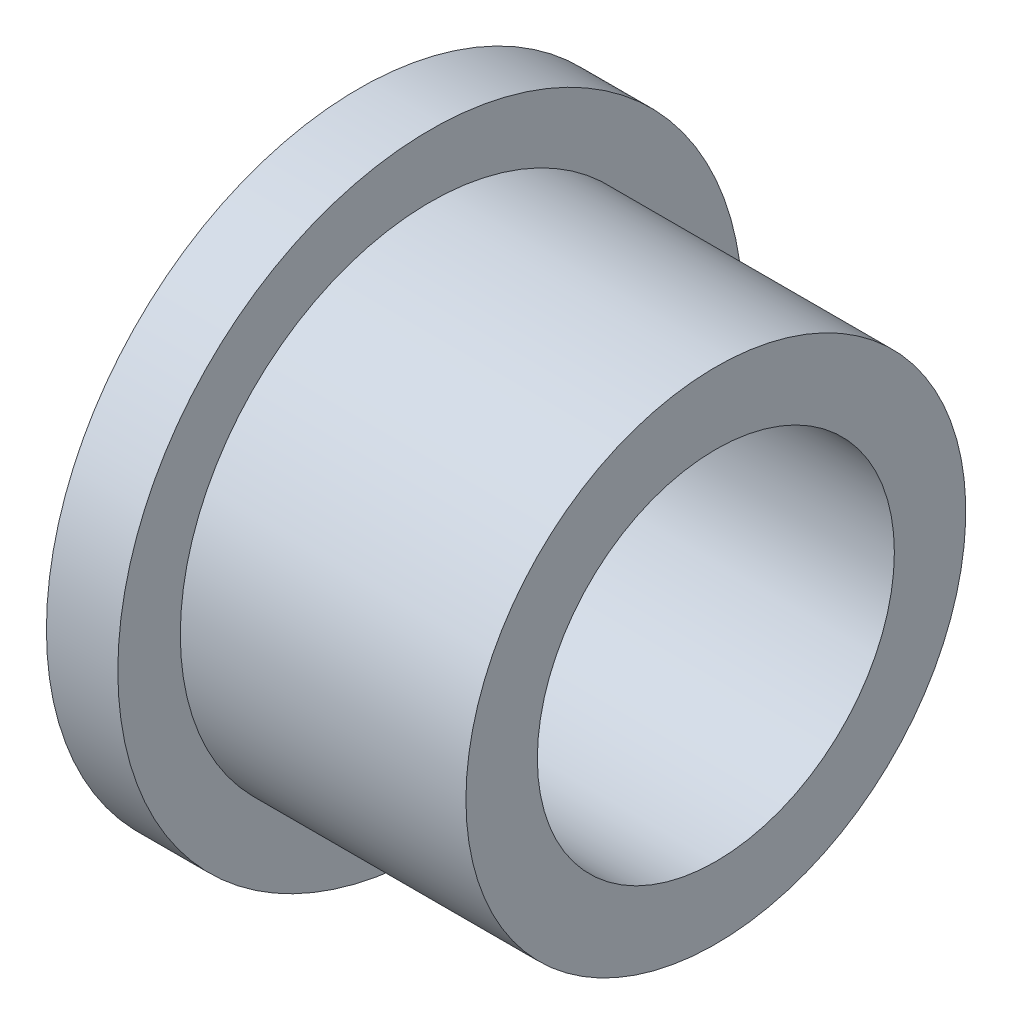
from build123d import *


with BuildPart() as part:
    # Sketch1 → Revolve1 (revolve)
    with BuildSketch(Plane.XY, mode=Mode.PRIVATE) as revolve1_sk:
        Polygon((0, 10), (20, 10), (20, 14), (4, 14), (4, 17.5), (0, 17.5), align=None)
    revolve(revolve1_sk.sketch.rotate(Axis((0, 0, 0), (1, 0, 0)), 90), axis=Axis((0, 0, 0), (1, 0, 0)))


solid = part.part
